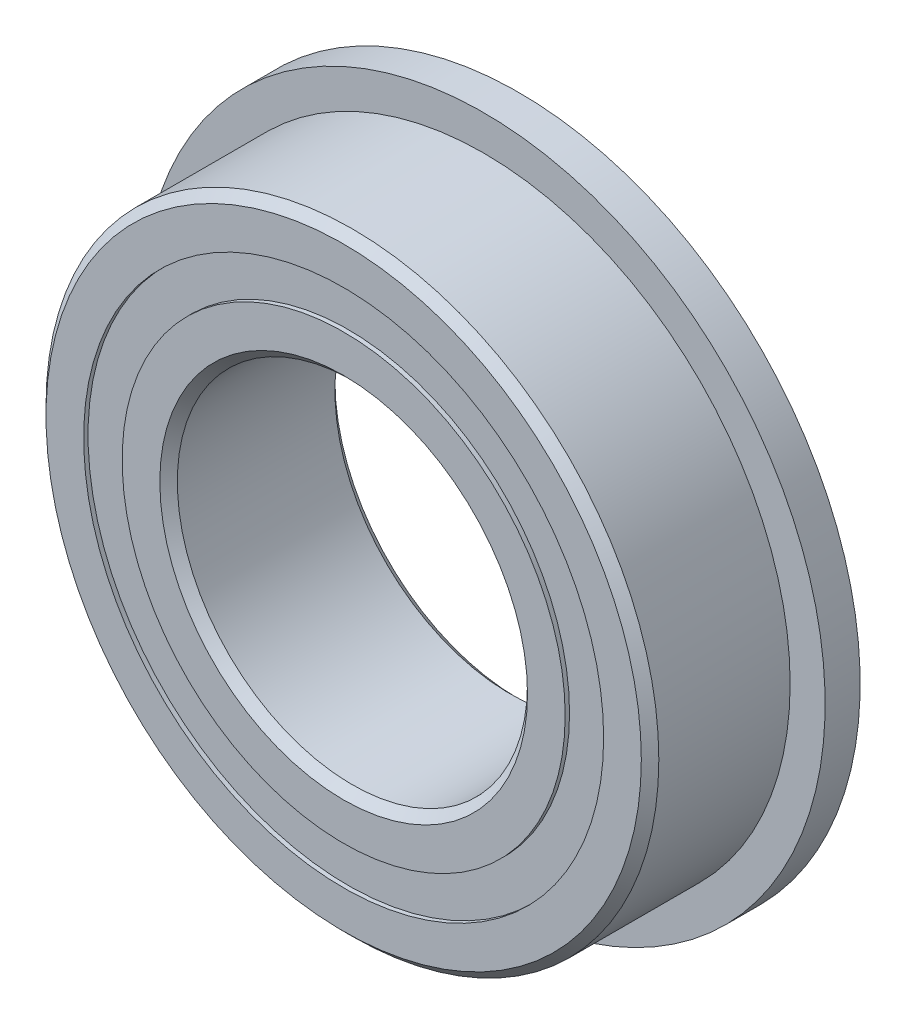
from build123d import *

# Parameters (mm, degrees)
CIRPATTERN1_COUNT = 12
SKETCH5_W         = 0.908366581
SKETCH5_H         = 0.87912088
SKETCH6_W         = 0.8
SKETCH6_H         = 1.86043956


with BuildPart() as part:
    # Sketch1 → Revolve1 (revolve)
    with BuildSketch(Plane(origin=(0, 0, 0), x_dir=(0, 0, -1), z_dir=(1, 0, 0)), mode=Mode.PRIVATE) as revolve1_sk:
        with BuildLine():
            Line((1.8, 7), (-1.8, 7))
            Line((-1.8, 7), (-2, 6.8))
            Line((-2, 6.8), (-2, 5.93956044))
            Line((-2, 5.93956044), (-0.888888889, 5.93956044))
            ThreePointArc((-0.888888889, 5.93956044), (0, 6.491633419), (0.888888889, 5.93956044))
            Line((0.888888889, 5.93956044), (2, 5.93956044))
            Line((2, 5.93956044), (2, 6.8))
            Line((2, 6.8), (1.8, 7))
        make_face()
    revolve(revolve1_sk.sketch.rotate(Axis((0, 0, 2), (0, 0, -1)), 90), axis=Axis((0, 0, 2), (0, 0, -1)))

    # Sketch6 → Revolve6 (revolve)
    with BuildSketch(Plane(origin=(0, 0, 0), x_dir=(0, 0, -1), z_dir=(1, 0, 0)), mode=Mode.PRIVATE) as revolve6_sk:
        with Locations((1.6, 6.86978022)):
            Rectangle(SKETCH6_W, SKETCH6_H)
    revolve(revolve6_sk.sketch.rotate(Axis((0, 0, -2), (0, 0, 1)), 270), axis=Axis((0, 0, -2), (0, 0, 1)))


with BuildPart() as body_2:
    # Sketch3 → Revolve3 (revolve)
    with BuildSketch(Plane(origin=(0, 0, 0), x_dir=(0, 0, -1), z_dir=(1, 0, 0)), mode=Mode.PRIVATE) as revolve3_sk:
        with BuildLine():
            Line((-2, 5.06043956), (-0.888888889, 5.06043956))
            ThreePointArc((-0.888888889, 5.06043956), (0, 4.508366581), (0.888888889, 5.06043956))
            Line((0.888888889, 5.06043956), (2, 5.06043956))
            Line((2, 5.06043956), (2, 4.2))
            Line((2, 4.2), (1.8, 4))
            Line((1.8, 4), (-1.8, 4))
            Line((-1.8, 4), (-2, 4.2))
            Line((-2, 4.2), (-2, 5.06043956))
        make_face()
    revolve(revolve3_sk.sketch.rotate(Axis((0, 0, 2), (0, 0, -1)), 90), axis=Axis((0, 0, 2), (0, 0, -1)))


with BuildPart() as body_3:
    # Sketch4 → Revolve4 (revolve)
    with BuildSketch(Plane(origin=(0, 0, 0), x_dir=(0, 0, -1), z_dir=(1, 0, 0))):
        with BuildLine():
            Line((-0.991633419, 5.5), (0.991633419, 5.5))
            ThreePointArc((0.991633419, 5.5), (0, 6.491633419), (-0.991633419, 5.5))
        make_face()
    revolve(axis=Axis((0, 5.5, 0.991633419), (0, 0, -1)))


with BuildPart() as cirpattern1_1:
    # CirPattern1: pattern copy
    add(body_3.part.rotate(Axis((0, 0, 0), (0, 0, 1)), 1 * 360 / CIRPATTERN1_COUNT))


with BuildPart() as cirpattern1_2:
    # CirPattern1: pattern copy
    add(body_3.part.rotate(Axis((0, 0, 0), (0, 0, 1)), 2 * 360 / CIRPATTERN1_COUNT))


with BuildPart() as cirpattern1_3:
    # CirPattern1: pattern copy
    add(body_3.part.rotate(Axis((0, 0, 0), (0, 0, 1)), 3 * 360 / CIRPATTERN1_COUNT))


with BuildPart() as cirpattern1_4:
    # CirPattern1: pattern copy
    add(body_3.part.rotate(Axis((0, 0, 0), (0, 0, 1)), 4 * 360 / CIRPATTERN1_COUNT))


with BuildPart() as cirpattern1_5:
    # CirPattern1: pattern copy
    add(body_3.part.rotate(Axis((0, 0, 0), (0, 0, 1)), 5 * 360 / CIRPATTERN1_COUNT))


with BuildPart() as cirpattern1_6:
    # CirPattern1: pattern copy
    add(body_3.part.rotate(Axis((0, 0, 0), (0, 0, 1)), 6 * 360 / CIRPATTERN1_COUNT))


with BuildPart() as cirpattern1_7:
    # CirPattern1: pattern copy
    add(body_3.part.rotate(Axis((0, 0, 0), (0, 0, 1)), 7 * 360 / CIRPATTERN1_COUNT))


with BuildPart() as cirpattern1_8:
    # CirPattern1: pattern copy
    add(body_3.part.rotate(Axis((0, 0, 0), (0, 0, 1)), 8 * 360 / CIRPATTERN1_COUNT))


with BuildPart() as cirpattern1_9:
    # CirPattern1: pattern copy
    add(body_3.part.rotate(Axis((0, 0, 0), (0, 0, 1)), 9 * 360 / CIRPATTERN1_COUNT))


with BuildPart() as cirpattern1_10:
    # CirPattern1: pattern copy
    add(body_3.part.rotate(Axis((0, 0, 0), (0, 0, 1)), 10 * 360 / CIRPATTERN1_COUNT))


with BuildPart() as cirpattern1_11:
    # CirPattern1: pattern copy
    add(body_3.part.rotate(Axis((0, 0, 0), (0, 0, 1)), 11 * 360 / CIRPATTERN1_COUNT))


with BuildPart() as body_15:
    # Sketch5 → Revolve5 (revolve)
    with BuildSketch(Plane(origin=(0, 0, 0), x_dir=(0, 0, -1), z_dir=(1, 0, 0)), mode=Mode.PRIVATE) as revolve5_sk:
        with Locations((-1.44581671, 5.5)):
            Rectangle(SKETCH5_W, SKETCH5_H)
        with Locations((1.44581671, 5.5)):
            Rectangle(SKETCH5_W, SKETCH5_H)
    revolve(revolve5_sk.sketch.rotate(Axis((0, 0, 2), (0, 0, -1)), 90), axis=Axis((0, 0, 2), (0, 0, -1)))


solid = Compound([part.part, body_2.part, body_3.part, cirpattern1_1.part, cirpattern1_2.part, cirpattern1_3.part, cirpattern1_4.part, cirpattern1_5.part, cirpattern1_6.part, cirpattern1_7.part, cirpattern1_8.part, cirpattern1_9.part, cirpattern1_10.part, cirpattern1_11.part, body_15.part])
